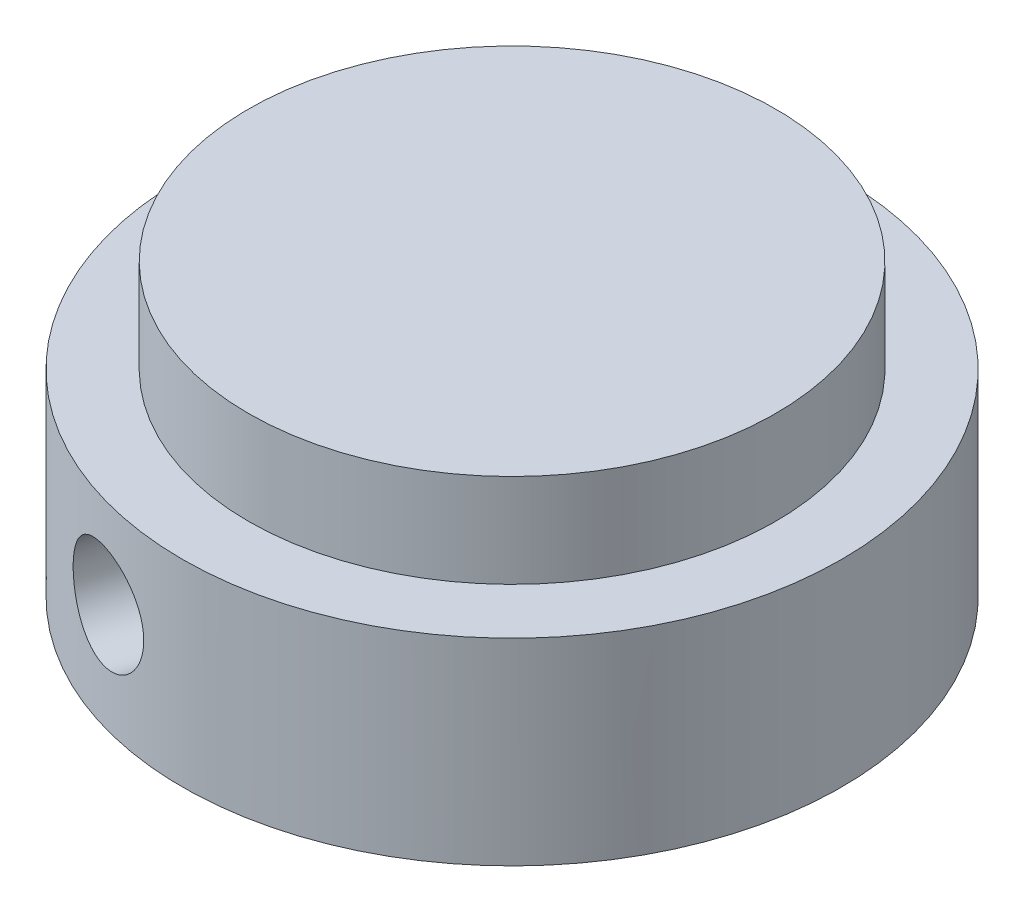
from build123d import *

# Parameters (mm, degrees)
SKETCH1_R                 = 6.35
BOSS_EXTRUDE1_DEPTH       = 6.95
SKETCH2_R                 = 7.542662581
SKETCH2_R_2               = 4
CUT_EXTRUDE1_DEPTH        = 1.35
SKETCH3_R                 = 7.419476018
SKETCH3_R_2               = 5.08
CUT_EXTRUDE2_DEPTH        = 1.8
F_2_0MM_DOWEL_HOLE1_D     = 2
F_2_0MM_DOWEL_HOLE1_DEPTH = 2
F_2_0MM_DOWEL_HOLE1_TIP   = 0.600860619


with BuildPart() as part:
    # Sketch1 → Boss-Extrude1 (new body)
    with BuildSketch(Plane(origin=(0, 0, 0), x_dir=(1, 0, 0), z_dir=(0, 1, 0))):
        with Locations(Location((0, 0, 0), (0, 0, 270))):
            Circle(SKETCH1_R)
    extrude(amount=BOSS_EXTRUDE1_DEPTH)

    # Sketch2 → Cut-Extrude1 (cut)
    with BuildSketch(Plane.XZ):
        Circle(SKETCH2_R)
        with Locations(Location((0, 0, 0), (0, 0, 270))):
            Circle(SKETCH2_R_2, mode=Mode.SUBTRACT)
    extrude(amount=-CUT_EXTRUDE1_DEPTH, mode=Mode.SUBTRACT)

    # Sketch3 → Cut-Extrude2 (cut)
    with BuildSketch(Plane(origin=(0, 6.95, 0), x_dir=(1, 0, 0), z_dir=(0, 1, 0))):
        Circle(SKETCH3_R)
        with Locations(Location((0, 0, 0), (0, 0, 270))):
            Circle(SKETCH3_R_2, mode=Mode.SUBTRACT)
    extrude(amount=-CUT_EXTRUDE2_DEPTH, mode=Mode.SUBTRACT)

    # Ø2.0mm Dowel Hole1
    with Locations(Plane(origin=(-1.779430565, 3.37, 6.09558257), x_dir=(0.95993426294, 0, 0.280225285859), z_dir=(-0.280225285859, 0, 0.95993426294))):
        with Locations((0, 0)):
            Hole(F_2_0MM_DOWEL_HOLE1_D / 2, depth=F_2_0MM_DOWEL_HOLE1_DEPTH)
            with Locations((0, 0, -(F_2_0MM_DOWEL_HOLE1_DEPTH + F_2_0MM_DOWEL_HOLE1_TIP / 2))):  # 118° drill point
                Cone(0, F_2_0MM_DOWEL_HOLE1_D / 2, F_2_0MM_DOWEL_HOLE1_TIP, mode=Mode.SUBTRACT)


solid = part.part
